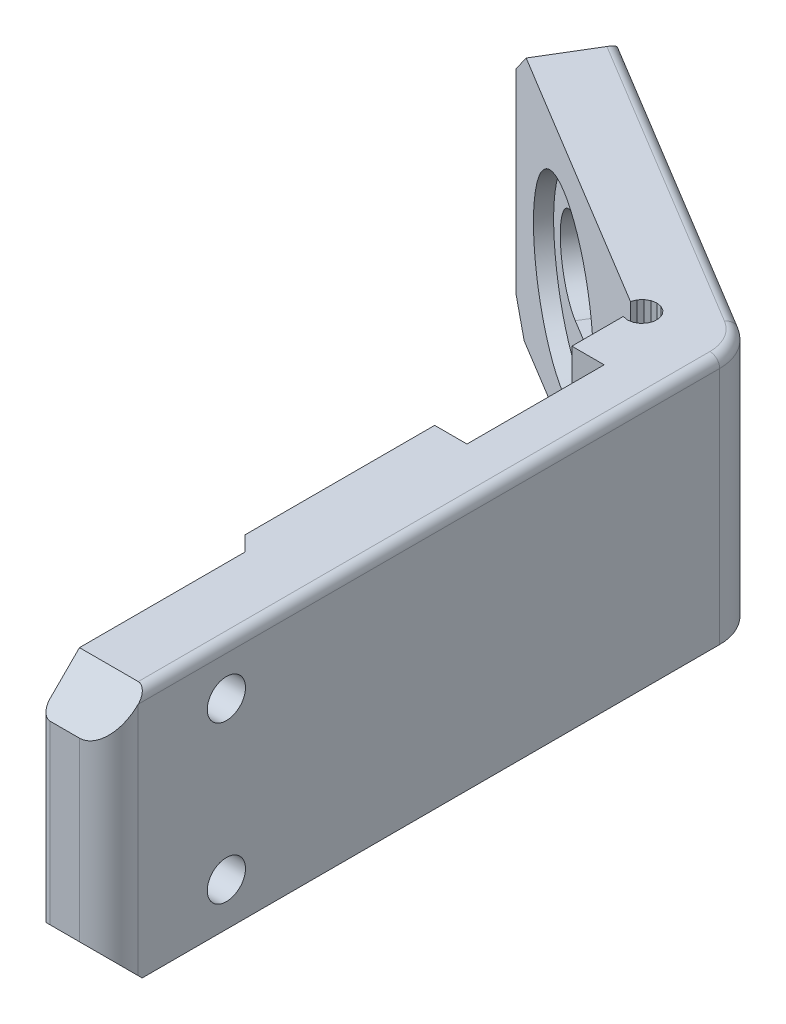
from build123d import *

# Parameters (mm, degrees)
LEG_AND_PAD_DEPTH          = 13
SCREW_HEAD_RELIEF_SKETCH_W = 14
SCREW_HEAD_RELIEF_SKETCH_H = 6
SCREW_HEAD_RELIEF_DEPTH    = 2.35
M6_SLOT_MIDDLE_DEPTH       = 4.5
SCREW_HOLES_SKETCH_R       = 1.95
SCREW_HOLES_DEPTH          = 4.5
LEG_TOP_CORNERS_SIZE       = 4
PAD_END_CORNERS_SIZE       = 4
OUTSIDE_OF_THE_BEND_R      = 5
LEG_TOP_OUTER_EDGE_R       = 3
PAD_END_OUTER_EDGE_R       = 3
LEG_TOP_INNER_EDGE_R       = 1
PAD_END_INNER_EDGE_R       = 1
BED_FACE_CHAMFER_SIZE      = 0.6
TOP_FACE_EDGE_R            = 1


with BuildPart() as part:
    # leg and pad sketch → leg and pad (new, symmetric)
    with BuildSketch(Plane(origin=(0, -20.7, 0), x_dir=(1, 0, 0), z_dir=(0, 1, 0))):
        Polygon((-0.551289683, 30.332713936), (-0.367250577, 30.819395741), (-0.028023026, 31.213926146), (0.425575667, 31.468833575), (0.938966578, 31.553446481), (1.450376329, 31.457583879), (1.898269923, 31.192780366), (2.228754897, 30.790898227), (2.402065893, 30.30029363), (2.397349395, 29.779998208), (2.215172912, 29.292616119), (1.877456693, 28.896791249), (1.424836191, 28.640150931), (0.91177263, 28.55357522), (0.4, 28.647481273), (0.4, -9.98), (1.92, -11.5), (1.92, -32.37), (8.92, -32.37), (8.92, 32.792642706), (-27.204821487, 54.594667874), (-30.821788068, 48.601542416), align=None)
    extrude(amount=LEG_AND_PAD_DEPTH, both=True)

    # screw head relief sketch → screw head relief (cut, symmetric)
    with BuildSketch(Plane(origin=(1.35, 0, 0), x_dir=(0, 0, -1), z_dir=(1, 0, 0))):
        with Locations((16.4, -9.7)):
            Rectangle(SCREW_HEAD_RELIEF_SKETCH_W, SCREW_HEAD_RELIEF_SKETCH_H)
    extrude(amount=SCREW_HEAD_RELIEF_DEPTH, both=True, mode=Mode.SUBTRACT)

    # insert flange relief sketch → insert flange relief (revolve, cut)
    with BuildSketch(Plane(origin=(0, -20.7, 0), x_dir=(1, 0, 0), z_dir=(0, 1, 0))):
        Polygon((-18.324853729, 39.891397061), (-17.03307995, 42.03179901), (-9.327632933, 37.381413406), (-10.619406712, 35.241011457), align=None)
    revolve(axis=Axis((-18.324853729, -20.7, -39.891397061), (0.5167095115681243, 0, -0.8561607796757748)), mode=Mode.SUBTRACT)

    # M6 slot end 1 sketch → M6 slot end 1 (revolve, cut)
    with BuildSketch(Plane(origin=(0, -20.7, 0), x_dir=(1, 0, 0), z_dir=(0, 1, 0))):
        Polygon((-20.465255678, 41.18317084), (-15.814870074, 48.888617857), (-11.962146565, 46.563425055), (-16.612532169, 38.857978038), align=None)
    revolve(axis=Axis((-20.465255678, -20.7, -41.18317084), (0.5167095115681236, 0, -0.8561607796757752)), mode=Mode.SUBTRACT)

    # M6 slot end 2 sketch → M6 slot end 2 (revolve, cut)
    with BuildSketch(Plane(origin=(0, -20.7, 0), x_dir=(1, 0, 0), z_dir=(0, 1, 0))):
        Polygon((-16.18445178, 38.599623282), (-11.534066176, 46.305070299), (-7.681342667, 43.979877497), (-12.331728271, 36.27443048), align=None)
    revolve(axis=Axis((-16.18445178, -20.7, -38.599623282), (0.5167095115681234, 0, -0.8561607796757752)), mode=Mode.SUBTRACT)

    # M6 slot middle sketch → M6 slot middle (cut, symmetric)
    with BuildSketch(Plane(origin=(0, -20.7, 0), x_dir=(1, 0, 0), z_dir=(0, 1, 0))):
        Polygon((-16.18445178, 38.599623282), (-20.465255678, 41.18317084), (-15.814870074, 48.888617857), (-11.534066176, 46.305070299), align=None)
    extrude(amount=M6_SLOT_MIDDLE_DEPTH, both=True, mode=Mode.SUBTRACT)

    # screw holes sketch → screw holes (cut, symmetric)
    with BuildSketch(Plane(origin=(5.42, 0, 0), x_dir=(0, 0, -1), z_dir=(1, 0, 0))):
        with Locations((-20.375, -28.7)):
            Circle(SCREW_HOLES_SKETCH_R)
        with Locations((-20.375, -12.7)):
            Circle(SCREW_HOLES_SKETCH_R)
    extrude(amount=SCREW_HOLES_DEPTH, both=True, mode=Mode.SUBTRACT)

    # leg top corners
    leg_top_corners_edges = [part.edges().sort_by_distance(p)[0] for p in [
        (5.42, -33.7, 32.37),
        (5.42, -7.7, 32.37),
    ]]
    chamfer(leg_top_corners_edges, length=LEG_TOP_CORNERS_SIZE)

    # pad end corners
    pad_end_corners_edges = [part.edges().sort_by_distance(p)[0] for p in [
        (-29.013304778, -33.7, -51.598105145),
        (-29.013304778, -7.7, -51.598105145),
    ]]
    chamfer(pad_end_corners_edges, length=PAD_END_CORNERS_SIZE)

    # outside of the bend
    outside_of_the_bend_edges = [part.edges().sort_by_distance(p)[0] for p in [
        (8.92, -20.7, -32.792642706),
    ]]
    fillet(outside_of_the_bend_edges, radius=OUTSIDE_OF_THE_BEND_R)

    # leg top outer edge
    leg_top_outer_edge_edges = [part.edges().sort_by_distance(p)[0] for p in [
        (8.92, -20.7, 32.37),
    ]]
    fillet(leg_top_outer_edge_edges, radius=LEG_TOP_OUTER_EDGE_R)

    # pad end outer edge
    pad_end_outer_edge_edges = [part.edges().sort_by_distance(p)[0] for p in [
        (-27.204821487, -20.7, -54.594667874),
    ]]
    fillet(pad_end_outer_edge_edges, radius=PAD_END_OUTER_EDGE_R)

    # leg top inner edge
    leg_top_inner_edge_edges = [part.edges().sort_by_distance(p)[0] for p in [
        (1.92, -20.7, 32.37),
    ]]
    fillet(leg_top_inner_edge_edges, radius=LEG_TOP_INNER_EDGE_R)

    # pad end inner edge
    pad_end_inner_edge_edges = [part.edges().sort_by_distance(p)[0] for p in [
        (-30.821788068, -20.7, -48.601542416),
    ]]
    fillet(pad_end_inner_edge_edges, radius=PAD_END_INNER_EDGE_R)

    # bed face chamfer
    bed_face_chamfer_edges = [part.edges().sort_by_distance(p)[0] for p in [
        (-13.974217317, -33.7, -38.433709153),
        (-8.638315405, -33.7, -43.38942405),
        (1.92, -33.7, 19.935),
        (0.4, -33.7, -9.333740636),
        (8.274178326, -33.7, -32.428085628),
        (8.92, -33.7, -0.800107187),
    ]]
    chamfer(bed_face_chamfer_edges, length=BED_FACE_CHAMFER_SIZE)

    # top face edge
    top_face_edge_edges = [part.edges().sort_by_distance(p)[0] for p in [
        (-8.638315405, -7.7, -43.38942405),
        (8.274178326, -7.7, -32.428085628),
        (8.92, -7.7, -0.800107187),
    ]]
    fillet(top_face_edge_edges, radius=TOP_FACE_EDGE_R)


solid = part.part
